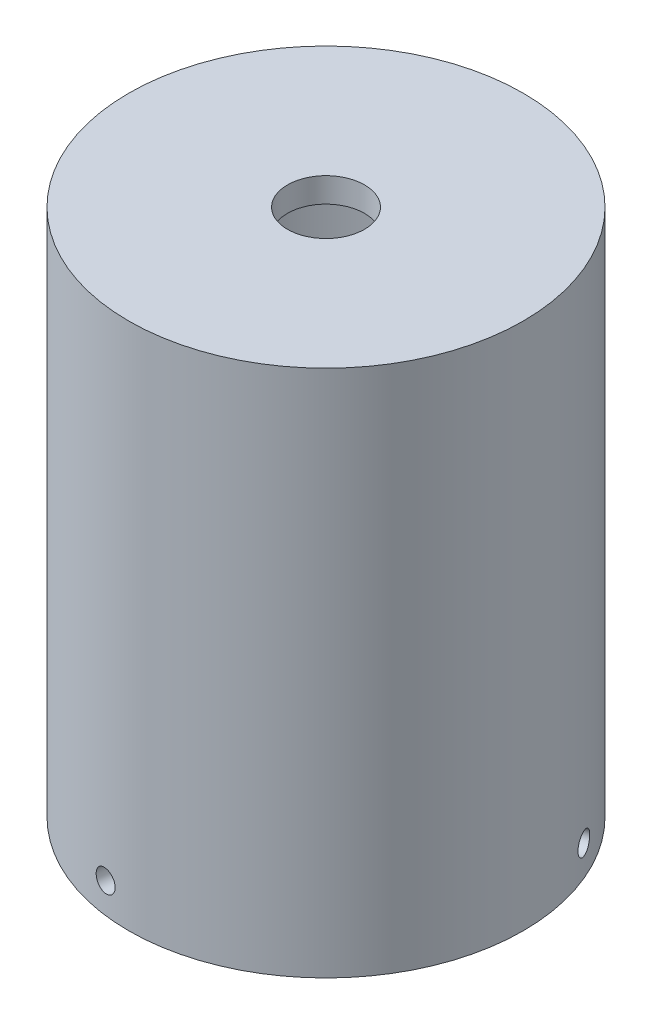
from build123d import *

# Parameters (mm, degrees)
SKETCH1_R           = 20.32
BOSS_EXTRUDE1_DEPTH = 58.70448
SHELL1_T            = -2.54
SKETCH2_R           = 3.96875
CUT_EXTRUDE1_DEPTH  = 64.089251174
CIRPATTERN1_COUNT   = 3
SKETCH9_R           = 20.32
CUT_EXTRUDE2_DEPTH  = 4.318


with BuildPart() as part:
    # Sketch1 → Boss-Extrude1 (new body)
    with BuildSketch(Plane(origin=(0, 0, 0), x_dir=(1, 0, 0), z_dir=(0, 1, 0))):
        with Locations(Location((0, 0, 0), (0, 0, 270))):
            Circle(SKETCH1_R)
    extrude(amount=BOSS_EXTRUDE1_DEPTH)

    # Shell1
    shell1_openings = [part.faces().sort_by_distance(p)[0] for p in [
        (0, 0, 0),
    ]]
    offset(amount=SHELL1_T, openings=shell1_openings, kind=Kind.INTERSECTION)

    # Sketch2 → Cut-Extrude1 (cut, through all)
    with BuildSketch(Plane.XZ.offset(-56.16448)):
        with Locations(Location((0, 0, 0), (0, 0, 270))):
            Circle(SKETCH2_R)
    extrude(amount=-CUT_EXTRUDE1_DEPTH, mode=Mode.SUBTRACT)

    # Sketch8 → #2 Clearance Hole1 (revolve, cut)
    with BuildSketch(Plane(origin=(-2.56879902, 7.424974445, 20.156975755), x_dir=(0.9919771533037619, 0, 0.1264172746240199), z_dir=(0, 1, 0))):
        Polygon((0, 0), (0, 9.838434313), (1.1303, 8.89), (1.1303, 0), align=None)
    f_2_clearance_hole1 = revolve(axis=Axis((-3.371548714, 7.424974445, 26.456030679), (0.1264172746240199, 0, -0.9919771533037619)), mode=Mode.SUBTRACT)

    # CirPattern1: #2 Clearance Hole1 ×3 about axis
    cirpattern1_axis = Axis((0, 58.70448, 0), (0, -1, 0))
    for i in range(1, CIRPATTERN1_COUNT):
        add(f_2_clearance_hole1.rotate(cirpattern1_axis, i * 360 / CIRPATTERN1_COUNT), mode=Mode.SUBTRACT)

    # Sketch9 → Cut-Extrude2 (cut)
    with BuildSketch(Plane.XZ):
        with Locations(Location((0, 0, 0), (0, 0, 270))):
            Circle(SKETCH9_R)
    extrude(amount=-CUT_EXTRUDE2_DEPTH, mode=Mode.SUBTRACT)


solid = part.part
